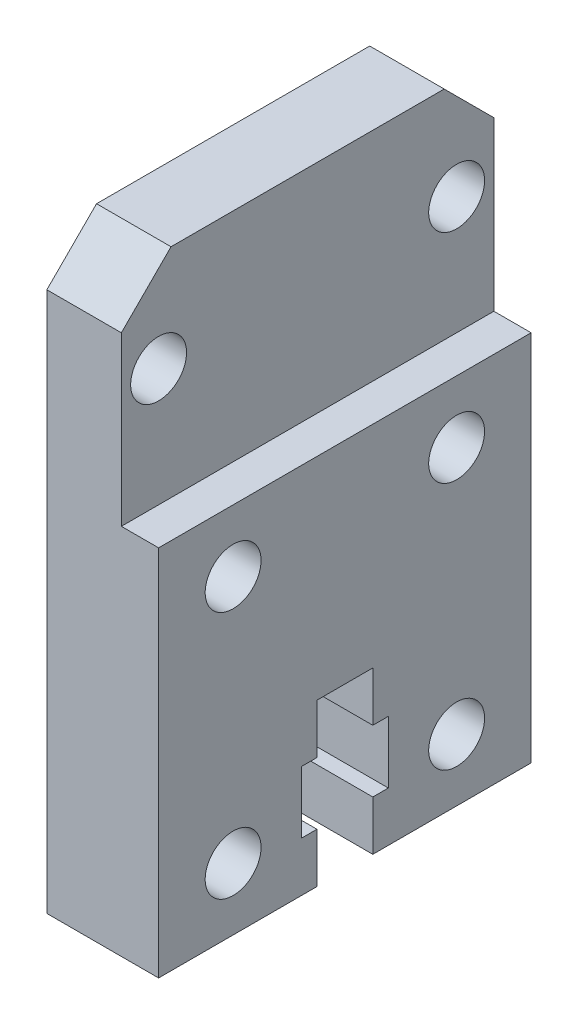
from build123d import *

# Parameters (mm, degrees)
SKETCH1_W           = 30
SKETCH1_H           = 47.5
BOSS_EXTRUDE1_DEPTH = 6
BOSS_EXTRUDE2_DEPTH = 30
BOSS_EXTRUDE3_DEPTH = 3
BOSS_EXTRUDE4_DEPTH = 12.5
SKETCH5_R           = 2.25
CUT_EXTRUDE1_DEPTH  = 49.106652347
SKETCH8_W           = 20
SKETCH8_H           = 15
CUT_EXTRUDE4_DEPTH  = 58.456505289
SKETCH9_R           = 2.25
CUT_EXTRUDE5_DEPTH  = 44.200115741
CUT_EXTRUDE6_DEPTH  = 5
CHAMFER1_SIZE       = 4
CUT_EXTRUDE7_DEPTH  = 44.200115741


with BuildPart() as part:
    # Sketch1 → Boss-Extrude1 (new body)
    with BuildSketch(Plane(origin=(0, 0, 0), x_dir=(0, 0, -1), z_dir=(1, 0, 0))):
        with Locations((0, -15.75)):
            Rectangle(SKETCH1_W, SKETCH1_H)
    extrude(amount=BOSS_EXTRUDE1_DEPTH)

    # Sketch2 → Boss-Extrude2 (add)
    with BuildSketch(Plane.XY.offset(15)):
        with BuildLine():
            Line((6, -39.5), (16.5, -39.5))
            Line((16.5, -39.5), (16.5, -32))
            ThreePointArc((16.5, -32), (11.196699141, -29.803300859), (9, -24.5))
            Line((9, -24.5), (9, -9.5))
            Line((9, -9.5), (6, -9.5))
            Line((6, -9.5), (6, -39.5))
        make_face()
    extrude(amount=-BOSS_EXTRUDE2_DEPTH)

    # Sketch3 → Boss-Extrude3 (add)
    with BuildSketch(Plane.XY.offset(15)):
        with BuildLine():
            Line((16.5, -29.5), (16.5, -32))
            ThreePointArc((16.5, -32), (11.196699141, -29.803300859), (9, -24.5))
            Line((9, -24.5), (11.5, -24.5))
            ThreePointArc((11.5, -24.5), (12.964466094, -28.035533906), (16.5, -29.5))
        make_face()
    boss_extrude3 = extrude(amount=-BOSS_EXTRUDE3_DEPTH)

    # Mirror1: Boss-Extrude3 across plane
    add(boss_extrude3.mirror(Plane.XY))

    # Sketch4 → Boss-Extrude4 (add)
    with BuildSketch(Plane(origin=(16.5, 0, 0), x_dir=(0, 0, -1), z_dir=(1, 0, 0))):
        Polygon((-12, -32), (12, -32), (12, -29.5), (15, -29.5), (15, -39.5), (-15, -39.5), (-15, -29.5), (-12, -29.5), align=None)
    extrude(amount=BOSS_EXTRUDE4_DEPTH)

    # Sketch5 → Cut-Extrude1 (cut, through all)
    with BuildSketch(Plane(origin=(6, 0, 0), x_dir=(0, 0, -1), z_dir=(1, 0, 0))):
        with Locations((-12, 0)):
            Circle(SKETCH5_R)
        with Locations((12, 0)):
            Circle(SKETCH5_R)
    extrude(amount=-CUT_EXTRUDE1_DEPTH, mode=Mode.SUBTRACT)

    # Sketch8 → Cut-Extrude4 (cut, through all)
    with BuildSketch(Plane.XY.offset(15)):
        with Locations((19, -32)):
            Rectangle(SKETCH8_W, SKETCH8_H)
    extrude(amount=-CUT_EXTRUDE4_DEPTH, mode=Mode.SUBTRACT)

    # Sketch9 → Cut-Extrude5 (cut, through all)
    with BuildSketch(Plane(origin=(9, 0, 0), x_dir=(0, 0, -1), z_dir=(1, 0, 0))):
        with Locations((-9, -14.5)):
            Circle(SKETCH9_R)
        with Locations((9, -14.5)):
            Circle(SKETCH9_R)
        with Locations((9, -34.5)):
            Circle(SKETCH9_R)
        with Locations((-9, -34.5)):
            Circle(SKETCH9_R)
    extrude(amount=-CUT_EXTRUDE5_DEPTH, mode=Mode.SUBTRACT)

    # Sketch10 → Cut-Extrude6 (cut)
    with BuildSketch(Plane.ZY):
        Polygon((-13.041451884, -14.5), (-11.020725942, -18), (-6.979274058, -18), (-4.958548116, -14.5), (-6.979274058, -11), (-11.020725942, -11), align=None)
        Polygon((4.958548116, -14.5), (6.979274058, -18), (11.020725942, -18), (13.041451884, -14.5), (11.020725942, -11), (6.979274058, -11), align=None)
        Polygon((4.958548116, -34.5), (6.979274058, -38), (11.020725942, -38), (13.041451884, -34.5), (11.020725942, -31), (6.979274058, -31), align=None)
        Polygon((-13.041451884, -34.5), (-11.020725942, -38), (-6.979274058, -38), (-4.958548116, -34.5), (-6.979274058, -31), (-11.020725942, -31), align=None)
    extrude(amount=-CUT_EXTRUDE6_DEPTH, mode=Mode.SUBTRACT)

    # Chamfer1
    chamfer1_edges = [part.edges().sort_by_distance(p)[0] for p in [
        (3, 8, -15),
        (3, 8, 15),
    ]]
    chamfer(chamfer1_edges, length=CHAMFER1_SIZE)

    # Sketch12 → Cut-Extrude7 (cut, through all)
    with BuildSketch(Plane(origin=(9, 0, 0), x_dir=(0, 0, -1), z_dir=(1, 0, 0))):
        Polygon((-2.25, -39.5), (2.25, -39.5), (2.25, -35.5), (3.5, -35.5), (3.5, -30.5), (2.25, -30.5), (2.25, -26.5), (-2.25, -26.5), (-2.25, -30.5), (-3.5, -30.5), (-3.5, -35.5), (-2.25, -35.5), align=None)
    extrude(amount=-CUT_EXTRUDE7_DEPTH, mode=Mode.SUBTRACT)


solid = part.part
